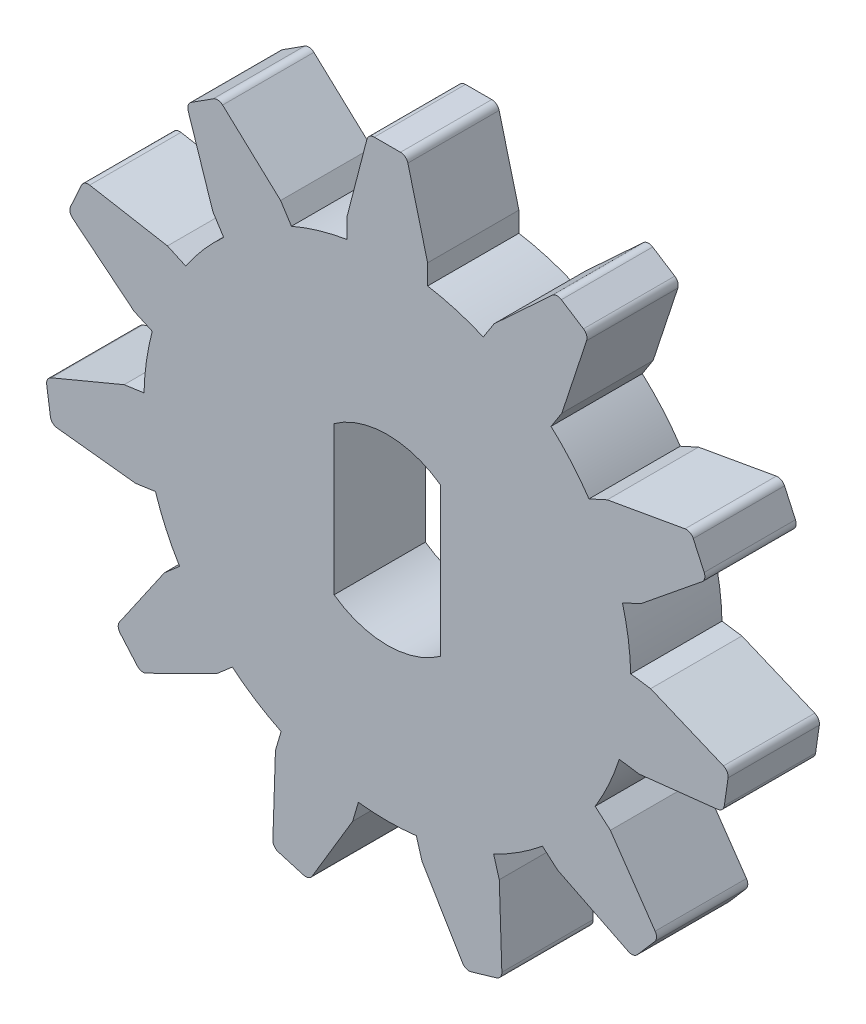
from build123d import *

# Parameters (mm, degrees)
SKETCH1_R                = 8
BOSS_EXTRUDE1_DEPTH      = 3
BOSS_EXTRUDE2_DEPTH      = 3
FILLET1_R                = 0.25
CIRPATTERN1_COUNT        = 11
FILLET1_OF_CIRPATTERN1_R = 0.25


with BuildPart() as part:
    # Sketch1 → Boss-Extrude1 (new body)
    with BuildSketch(Plane.XY):
        Circle(SKETCH1_R)
        with BuildLine():
            ThreePointArc((1.75, -2.436698586), (0, -3), (-1.75, -2.436698586))
            Line((-1.75, -2.436698586), (-1.75, 2.436698586))
            ThreePointArc((-1.75, 2.436698586), (0, 3), (1.75, 2.436698586))
            Line((1.75, 2.436698586), (1.75, -2.436698586))
        make_face(mode=Mode.SUBTRACT)
    extrude(amount=BOSS_EXTRUDE1_DEPTH)

    # Sketch2 → Boss-Extrude2 (add)
    with BuildSketch(Plane.XY):
        Polygon((-1.323267478, 7.75), (-1.323267478, 8.55), (-0.625, 11.25), (0.625, 11.25), (1.323267478, 8.55), (1.323267478, 7.75), align=None)
    boss_extrude2 = extrude(amount=BOSS_EXTRUDE2_DEPTH)

    # Fillet1
    fillet1_edges = [part.edges().sort_by_distance(p)[0] for p in [
        (0.625, 11.25, 1.5),
        (-0.625, 11.25, 1.5),
    ]]
    fillet(fillet1_edges, radius=FILLET1_R)

    # CirPattern1: Boss-Extrude2 ×11 about axis
    cirpattern1_axis = Axis((0, 0, 0), (0, 0, 1))
    for i in range(1, CIRPATTERN1_COUNT):
        add(boss_extrude2.rotate(cirpattern1_axis, i * 360 / CIRPATTERN1_COUNT))

    # Fillet1 of CirPattern1
    fillet1_of_cirpattern1_edges = [part.edges().sort_by_distance(p)[0] for p in [
        (-5.556425738, 9.802002755, 1.5),
        (-6.607992654, 9.126201733, 1.5),
        (-9.973725565, 5.241938893, 1.5),
        (-10.492994331, 4.104898899, 1.5),
        (-11.224437995, -0.982403529, 1.5),
        (-11.046544447, -2.219680332, 1.5),
        (-8.91147067, -6.894839773, 1.5),
        (-8.092894753, -7.839526741, 1.5),
        (-3.769174373, -10.618213105, 1.5),
        (-2.569808156, -10.970378801, 1.5),
        (2.569808156, -10.970378801, 1.5),
        (3.769174373, -10.618213105, 1.5),
        (8.092894753, -7.839526741, 1.5),
        (8.91147067, -6.894839773, 1.5),
        (11.046544447, -2.219680332, 1.5),
        (11.224437995, -0.982403529, 1.5),
        (10.492994331, 4.104898899, 1.5),
        (9.973725565, 5.241938893, 1.5),
        (6.607992654, 9.126201733, 1.5),
        (5.556425738, 9.802002755, 1.5),
    ]]
    fillet(fillet1_of_cirpattern1_edges, radius=FILLET1_OF_CIRPATTERN1_R)


solid = part.part
